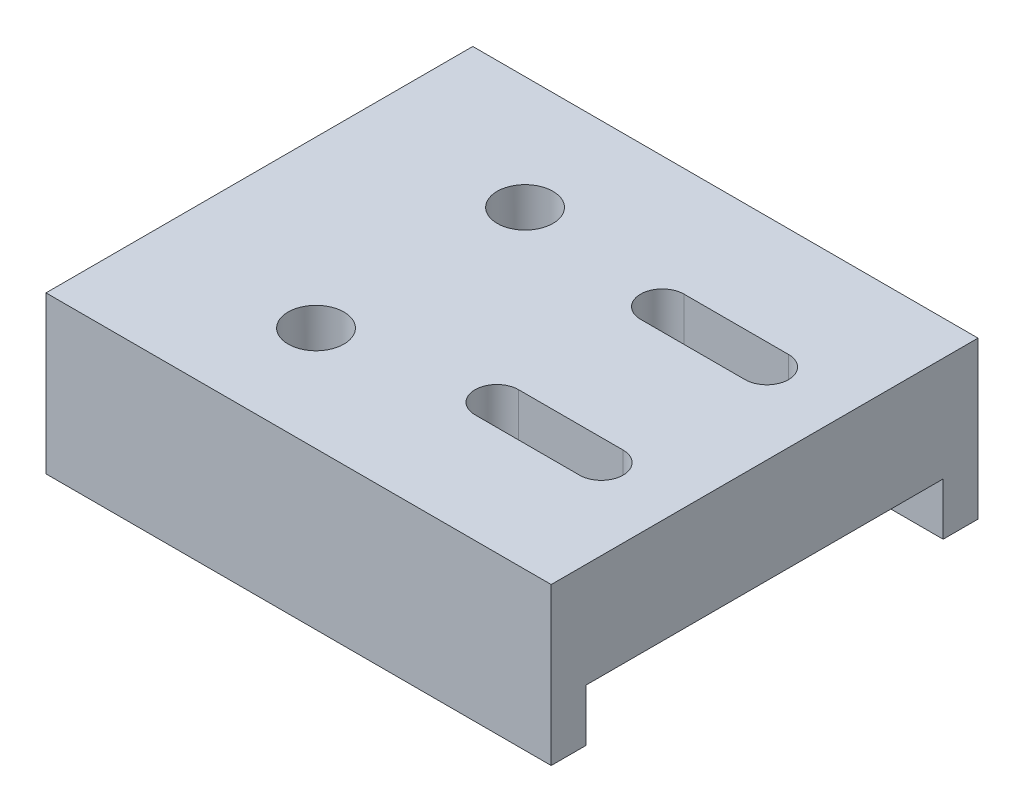
from build123d import *

# Parameters (mm, degrees)
EXTRU_MINCE1_DEPTH      = 9.5
ESQUISSE2_R             = 1.6
ENL_V_MAT_EXTRU_1_DEPTH = 30.774149862
ENL_V_START             = -2.5
ESQUISSE4_R             = 3.1
ENL_V_MAT_EXTRU_3_DEPTH = 28.274149862
SKETCH2_W               = 19
SKETCH2_H               = 8
CUT_EXTRUDE2_DEPTH      = 26.069902273
SKETCH4_W               = 19
SKETCH4_H               = 2
BOSS_EXTRUDE2_DEPTH     = 3
BOSS_EXTRUDE3_DEPTH     = 10
LPATTERN1_COUNT         = 2
LPATTERN1_PITCH         = 12
SKETCH8_R               = 1.25
CUT_EXTRUDE7_DEPTH      = 32.882597134
CUT_EXTRUDE8_DEPTH      = 32.882597134


with BuildPart() as part:
    # Esquisse1 → Extru.-Mince1 (new, symmetric)
    with BuildSketch(Plane(origin=(0, 0, 0), x_dir=(0, 0, -1), z_dir=(1, 0, 0))):
        Polygon((24.5, 0), (0, 0), (0, -14), (6, -14), (6, -6), (24.5, -6), align=None)
    extrude(amount=EXTRU_MINCE1_DEPTH, both=True)

    # Esquisse2 → Enlèv. mat.-Extru.1 (cut, through all)
    with BuildSketch(Plane(origin=(0, 0, 0), x_dir=(1, 0, 0), z_dir=(0, 1, 0))):
        with Locations((0, 18)):
            Circle(ESQUISSE2_R)
    enl_v_mat_extru_1 = extrude(amount=-ENL_V_MAT_EXTRU_1_DEPTH, mode=Mode.SUBTRACT)

    # Esquisse4 → Enlèv. mat.-Extru.3 (cut, through all)
    with BuildSketch(Plane(origin=(0, 0, 0), x_dir=(1, 0, 0), z_dir=(0, 1, 0)).offset(ENL_V_START)):
        with Locations((0, 18)):
            Circle(ESQUISSE4_R)
    enl_v_mat_extru_3 = extrude(amount=-ENL_V_MAT_EXTRU_3_DEPTH, mode=Mode.SUBTRACT)

    # Sketch2 → Cut-Extrude2 (cut, through all)
    with BuildSketch(Plane(origin=(0, 0, -6), x_dir=(-1, 0, 0), z_dir=(0, 0, -1))):
        with Locations((0, -10)):
            Rectangle(SKETCH2_W, SKETCH2_H)
    extrude(amount=-CUT_EXTRUDE2_DEPTH, mode=Mode.SUBTRACT)

    # Sketch4 → Boss-Extrude2 (add)
    with BuildSketch(Plane.XZ.offset(6)):
        with Locations((0, -1)):
            Rectangle(SKETCH4_W, SKETCH4_H)
        with Locations((0, -23.5)):
            Rectangle(SKETCH4_W, SKETCH4_H)
    extrude(amount=BOSS_EXTRUDE2_DEPTH)

    # Sketch5 → Boss-Extrude3 (add)
    with BuildSketch(Plane(origin=(9.5, 0, 0), x_dir=(0, 0, -1), z_dir=(1, 0, 0))):
        Polygon((0, 0), (0, -9), (2, -9), (2, -6), (22.5, -6), (22.5, -9), (24.5, -9), (24.5, 0), align=None)
    extrude(amount=BOSS_EXTRUDE3_DEPTH)

    # LPattern1: Enlèv. mat.-Extru.1, Enlèv. mat.-Extru.3 ×2
    with Locations(*[(0, 0, i * LPATTERN1_PITCH) for i in range(1, LPATTERN1_COUNT)]):
        add(enl_v_mat_extru_1, mode=Mode.SUBTRACT)
        add(enl_v_mat_extru_3, mode=Mode.SUBTRACT)

    # Sketch8 → Cut-Extrude7 (cut, through all)
    with BuildSketch(Plane.XZ.offset(6)):
        with Locations((14.877046193, -17)):
            Circle(SKETCH8_R)
        with Locations((14.877046193, -7.5)):
            Circle(SKETCH8_R)
    extrude(amount=-CUT_EXTRUDE7_DEPTH, mode=Mode.SUBTRACT)

    # Sketch9 → Cut-Extrude8 (cut, through all)
    with BuildSketch(Plane.XZ.offset(6)):
        with BuildLine():
            Line((14.877046193, -8.75), (8.877046193, -8.75))
            ThreePointArc((8.877046193, -8.75), (7.627046193, -7.5), (8.877046193, -6.25))
            Line((8.877046193, -6.25), (14.877046193, -6.25))
            ThreePointArc((14.877046193, -6.25), (16.127046193, -7.5), (14.877046193, -8.75))
        make_face()
        with BuildLine():
            Line((14.877046193, -18.25), (8.877046193, -18.25))
            ThreePointArc((8.877046193, -18.25), (7.627046193, -17), (8.877046193, -15.75))
            Line((8.877046193, -15.75), (14.877046193, -15.75))
            ThreePointArc((14.877046193, -15.75), (16.127046193, -17), (14.877046193, -18.25))
        make_face()
    extrude(amount=-CUT_EXTRUDE8_DEPTH, mode=Mode.SUBTRACT)


solid = part.part
